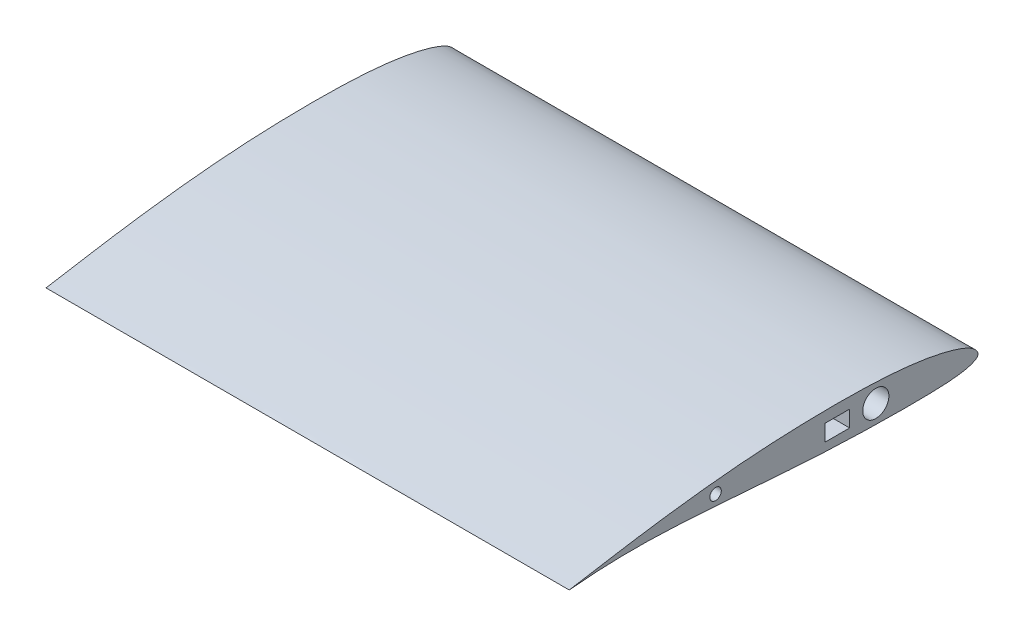
from build123d import *

# Parameters (mm, degrees)
SCHIZZO1_R                  = 8
SCHIZZO1_W                  = 15
SCHIZZO1_H                  = 10
CORPOFOAM_DEPTH             = 320
SCHIZZO2_R                  = 3.5
AGGANCIOPERNOSINISTRO_DEPTH = 15
AGGANCIOPERNODESTRO_START   = -15
SCHIZZO3_R                  = 3.5
AGGANCIOPERNODESTRO_DEPTH   = 15


with BuildPart() as part:
    # Schizzo1 → CorpoFoam (new body)
    with BuildSketch(Plane(origin=(0, 0, 0), x_dir=(0, 0, -1), z_dir=(1, 0, 0))):
        with BuildLine():
            add(Edge.make_bspline(
                [(-250, 0), (-250.000228294, -0.008042796), (-248.284955516, 0.172375658), (-246.518112419, 0.308690015), (-242.189387343, 0.685693594), (-236.806461263, 1.074101529), (-229.680385952, 1.49731724), (-221.184158698, 1.823218603), (-211.337618208, 1.967626101), (-200.371188527, 1.833221056), (-188.499913622, 1.38960529), (-175.953687417, 0.706014078), (-162.931424918, -0.160208642), (-149.615771744, -1.148016327), (-136.176354995, -2.19092491), (-122.767140548, -3.219583979), (-109.520053587, -4.152743127), (-96.546095975, -4.938564365), (-83.940819302, -5.536830703), (-71.801839291, -5.947648205), (-60.245256003, -6.218450939), (-49.398732891, -6.355369756), (-39.397226194, -6.381387963), (-30.361934842, -6.26504923), (-22.412181103, -6.012164917), (-15.626227231, -5.597433901), (-10.071907511, -4.928706579), (-5.697692612, -4.040446981), (-2.625320639, -2.865752984), (-0.494884225, -1.71152847), (0.021312549, -0.410454231), (-0.0311692, 0.792659827), (-0.812599242, 2.305684337), (-2.728863517, 4.238352424), (-5.769907241, 6.118172121), (-9.880942804, 7.913594202), (-15.074930468, 9.641318178), (-21.298752222, 11.283896488), (-28.49717212, 12.788381759), (-36.607373406, 14.097834908), (-45.57302844, 15.159429017), (-55.332910074, 15.960903998), (-65.816536498, 16.494069738), (-76.93137626, 16.791989705), (-88.566949028, 16.864754131), (-100.596999886, 16.726715291), (-112.888825982, 16.383385064), (-125.311615819, 15.825573667), (-137.743791097, 15.05233187), (-150.072384382, 14.059339074), (-162.191375056, 12.881586986), (-173.989074322, 11.549280346), (-185.352364446, 10.116249729), (-196.163081698, 8.632379125), (-206.300441402, 7.131513884), (-215.560350587, 5.731221768), (-223.977157043, 4.293295127), (-231.363413336, 3.181808874), (-237.746440904, 2.098942417), (-242.622069366, 1.245861917), (-246.644529332, 0.552864946), (-248.32839844, 0.246216765), (-249.999773563, 0.007977377), (-250, 0)],
                knots=[0, 0, 0, 0, 0.001588889, 0.006329218, 0.014202456, 0.025172808, 0.039173483, 0.056060631, 0.075578924, 0.097363607, 0.120926258, 0.145825281, 0.171670912, 0.198108537, 0.224790184, 0.25139058, 0.277643491, 0.30332675, 0.328257458, 0.352272548, 0.375156062, 0.396620664, 0.416422729, 0.43430442, 0.45005468, 0.463465465, 0.474478994, 0.483169222, 0.489678354, 0.494104066, 0.496910015, 0.497289785, 0.501214273, 0.50645795, 0.513356957, 0.522168632, 0.53296597, 0.545689209, 0.560220779, 0.576438923, 0.594258689, 0.613600245, 0.634342386, 0.656331109, 0.679351894, 0.703152303, 0.727478208, 0.752070739, 0.776691164, 0.801140184, 0.825214387, 0.848697424, 0.871352858, 0.892947449, 0.913230871, 0.931955467, 0.948342069, 0.963693004, 0.976235918, 0.986320059, 0.993788799, 0.998424035, 1, 1, 1, 1], degree=3))
        make_face()
        with Locations((-62.499919709, 5.077322704)):
            Circle(SCHIZZO1_R, mode=Mode.SUBTRACT)
        with Locations((-85.999919709, 5.077322704)):
            Rectangle(SCHIZZO1_W, SCHIZZO1_H, mode=Mode.SUBTRACT)
    extrude(amount=CORPOFOAM_DEPTH)

    # Schizzo2 → AggancioPernoSinistro (cut)
    with BuildSketch(Plane.ZY):
        with Locations((160.499919709, 6.077322704)):
            Circle(SCHIZZO2_R)
    extrude(amount=-AGGANCIOPERNOSINISTRO_DEPTH, mode=Mode.SUBTRACT)

    # Schizzo3 → AggancioPernoDestro (cut)
    with BuildSketch(Plane(origin=(320, 0, 0), x_dir=(0, 0, -1), z_dir=(1, 0, 0)).offset(AGGANCIOPERNODESTRO_START)):
        with Locations(Location((-160.499919709, 6.077322704, 0), (0, 0, 180))):
            Circle(SCHIZZO3_R)
    extrude(amount=AGGANCIOPERNODESTRO_DEPTH, mode=Mode.SUBTRACT)


solid = part.part
